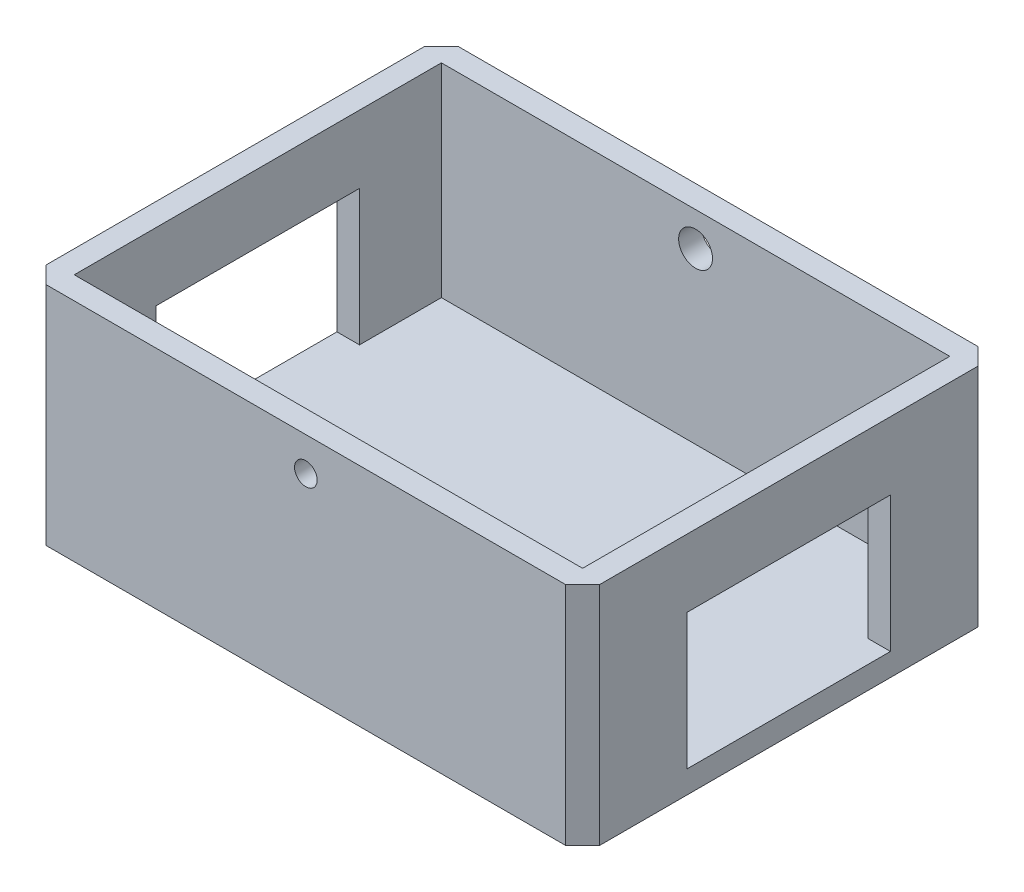
from build123d import *

# Parameters (mm, degrees)
SKETCH1_W           = 24.5
SKETCH1_H           = 18.25
BOSS_EXTRUDE1_DEPTH = 10
SHELL4_T            = -1
CHAMFER1_SIZE       = 0.75
CUT_EXTRUDE2_REACH  = 25.401
SKETCH8_R           = 0.75
CUT_EXTRUDE3_REACH  = 26.148
SKETCH9_R           = 0.5
CUT_EXTRUDE4_REACH  = 29.991
SKETCH10_W          = 9
SKETCH10_H          = 6


with BuildPart() as part:
    # Sketch1 → Boss-Extrude1 (new body)
    with BuildSketch(Plane(origin=(0, 0, 0), x_dir=(1, 0, 0), z_dir=(0, 1, 0))):
        Rectangle(SKETCH1_W, SKETCH1_H)
    extrude(amount=BOSS_EXTRUDE1_DEPTH)

    # Shell4
    shell4_openings = [part.faces().sort_by_distance(p)[0] for p in [
        (0, 10, 0),
    ]]
    offset(amount=SHELL4_T, openings=shell4_openings, kind=Kind.INTERSECTION)

    # Chamfer1
    chamfer1_edges = [part.edges().sort_by_distance(p)[0] for p in [
        (12.25, 5, 9.125),
        (-12.25, 5, 9.125),
        (-12.25, 5, -9.125),
        (12.25, 5, -9.125),
    ]]
    chamfer(chamfer1_edges, length=CHAMFER1_SIZE)

    # Sketch8 → Cut-Extrude2 (cut, up to next)
    with BuildSketch(Plane.XY.offset(-8.125), mode=Mode.PRIVATE) as cut_extrude2_sk1:
        with Locations((0, 8.5)):
            Circle(SKETCH8_R)
    cut_extrude2_tool1 = extrude(cut_extrude2_sk1.sketch, amount=-CUT_EXTRUDE2_REACH, mode=Mode.PRIVATE) & part.part
    add(cut_extrude2_tool1.solids().sort_by_distance((0, 8.5, -8.125))[0], mode=Mode.SUBTRACT)

    # Sketch9 → Cut-Extrude3 (cut, up to next)
    with BuildSketch(Plane.XY.offset(9.125), mode=Mode.PRIVATE) as cut_extrude3_sk1:
        with Locations((0, 8.5)):
            Circle(SKETCH9_R)
    cut_extrude3_tool1 = extrude(cut_extrude3_sk1.sketch, amount=-CUT_EXTRUDE3_REACH, mode=Mode.PRIVATE) & part.part
    add(cut_extrude3_tool1.solids().sort_by_distance((0, 8.5, 9.125))[0], mode=Mode.SUBTRACT)

    # Sketch10 → Cut-Extrude4 (cut, up to next)
    with BuildSketch(Plane(origin=(12.25, 0, 0), x_dir=(0, 0, -1), z_dir=(1, 0, 0)), mode=Mode.PRIVATE) as cut_extrude4_sk1:
        with Locations((0, 4)):
            Rectangle(SKETCH10_W, SKETCH10_H)
    cut_extrude4_tool1 = extrude(cut_extrude4_sk1.sketch, amount=-CUT_EXTRUDE4_REACH, mode=Mode.PRIVATE) & part.part
    cut_extrude4 = cut_extrude4_tool1.solids().sort_by_distance((12.25, 4, 0))[0]
    add(cut_extrude4, mode=Mode.SUBTRACT)

    # Mirror1: Cut-Extrude4 across plane
    add(cut_extrude4.mirror(Plane(origin=(0, 0, 0), x_dir=(0, 0, 1), z_dir=(1, 0, 0))), mode=Mode.SUBTRACT)


solid = part.part
